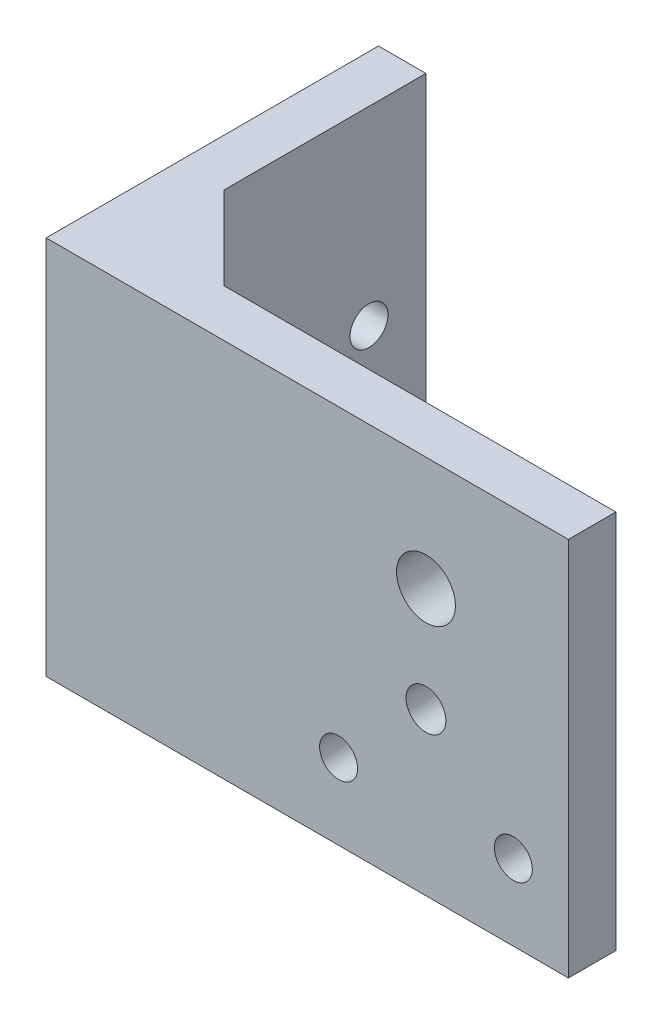
from build123d import *

# Parameters (mm, degrees)
BOSS_EXTRUDE3_DEPTH = 40
CUT_EXTRUDE1_DEPTH  = 35
BOSS_EXTRUDE4_DEPTH = 5
SKETCH7_R           = 3.1
SKETCH7_R_2         = 2.1
SKETCH7_R_3         = 2
CUT_EXTRUDE9_DEPTH  = 75.330343737
SKETCH16_R          = 2
CUT_EXTRUDE12_DEPTH = 73.972597597


with BuildPart() as part:
    # Sketch1 → Boss-Extrude3 (new body)
    with BuildSketch(Plane(origin=(0, 0, 0), x_dir=(1, 0, 0), z_dir=(0, 1, 0))):
        Polygon((0, 0), (55, 0), (55, 5), (13.75, 5), (5, 13.75), (5, 35), (0, 35), align=None)
    extrude(amount=BOSS_EXTRUDE3_DEPTH)

    # Sketch5 → Cut-Extrude1 (cut)
    with BuildSketch(Plane.XZ):
        Polygon((5, -13.75), (5, -5), (13.75, -5), align=None)
    extrude(amount=-CUT_EXTRUDE1_DEPTH, mode=Mode.SUBTRACT)

    # Sketch6 → Boss-Extrude4 (add)
    with BuildSketch(Plane.XZ):
        Polygon((13.75, -5), (5, -13.75), (5, -5), align=None)
    extrude(amount=-BOSS_EXTRUDE4_DEPTH)

    # Sketch7 → Cut-Extrude9 (cut, through all)
    with BuildSketch(Plane(origin=(0, 0, -5), x_dir=(-1, 0, 0), z_dir=(0, 0, -1))):
        with Locations((-40, 28)):
            Circle(SKETCH7_R)
        with Locations((-40, 17)):
            Circle(SKETCH7_R_2)
        with Locations((-49.2, 8)):
            Circle(SKETCH7_R_3)
        with Locations((-30.8, 8)):
            Circle(SKETCH7_R_3)
    extrude(amount=-CUT_EXTRUDE9_DEPTH, mode=Mode.SUBTRACT)

    # Sketch16 → Cut-Extrude12 (cut, through all)
    with BuildSketch(Plane(origin=(5, 0, 0), x_dir=(0, 0, -1), z_dir=(1, 0, 0))):
        with Locations((29, 20)):
            Circle(SKETCH16_R)
        with Locations((11, 31)):
            Circle(SKETCH16_R)
        with Locations((11, 9)):
            Circle(SKETCH16_R)
    extrude(amount=-CUT_EXTRUDE12_DEPTH, mode=Mode.SUBTRACT)


solid = part.part
